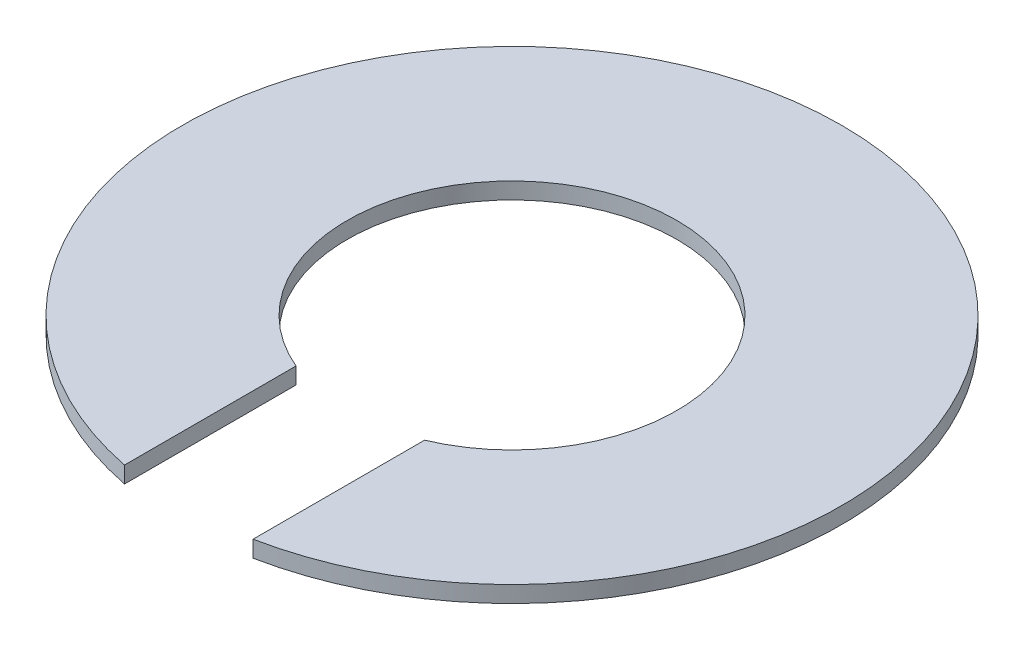
from build123d import *

# Parameters (mm, degrees)
BOSS_EXTRUDE1_DEPTH = 0.254


with BuildPart() as part:
    # Sketch1 → Boss-Extrude1 (new body)
    with BuildSketch(Plane(origin=(0, 0, 0), x_dir=(1, 0, 0), z_dir=(0, 1, 0))):
        with BuildLine():
            Line((-0.990450861, -4.98251012), (-0.990450861, -2.338932896))
            ThreePointArc((-0.990450861, -2.338932896), (0, 2.54), (0.990450861, -2.338932896))
            Line((0.990450861, -2.338932896), (0.990450861, -4.98251012))
            ThreePointArc((0.990450861, -4.98251012), (0, 5.08), (-0.990450861, -4.98251012))
        make_face()
    extrude(amount=BOSS_EXTRUDE1_DEPTH)


solid = part.part
